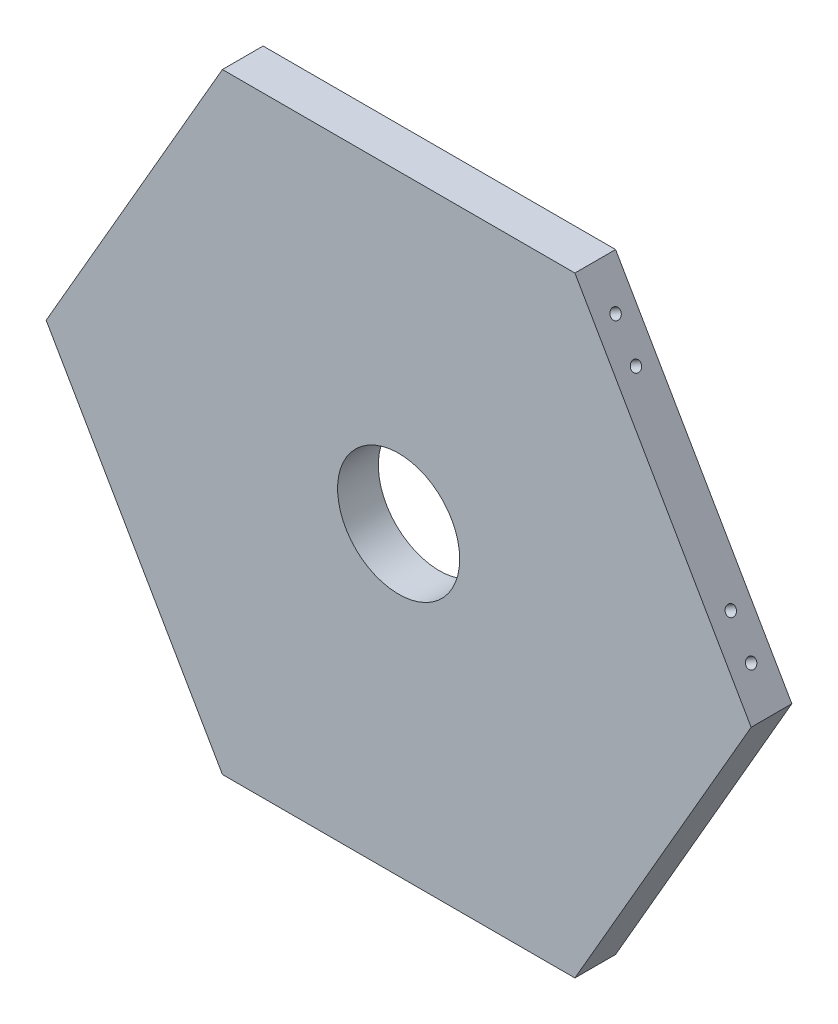
from build123d import *

# Parameters (mm, degrees)
BOSS_EXTRUDE1_DEPTH = 10
SKETCH2_R           = 1.25
CUT_EXTRUDE1_DEPTH  = 5
CIRPATTERN1_COUNT   = 3
SKETCH3_R           = 15
CUT_EXTRUDE2_DEPTH  = 10


with BuildPart() as part:
    # Sketch1 → Boss-Extrude1 (new body)
    with BuildSketch(Plane.XY):
        Polygon((43.301270189, -75), (86.602540378, 0), (43.301270189, 75), (-43.301270189, 75), (-86.602540378, 0), (-43.301270189, -75), align=None)
    extrude(amount=BOSS_EXTRUDE1_DEPTH)

    # Sketch2 → Cut-Extrude1 (cut)
    with BuildSketch(Plane.XZ.offset(75)):
        with Locations((-33.301270189, 5)):
            Circle(SKETCH2_R)
        with Locations((-23.301270189, 5)):
            Circle(SKETCH2_R)
        with Locations(Location((33.301270189, 5, 0), (0, 0, 180))):
            Circle(SKETCH2_R)
        with Locations(Location((23.301270189, 5, 0), (0, 0, 180))):
            Circle(SKETCH2_R)
    cut_extrude1 = extrude(amount=-CUT_EXTRUDE1_DEPTH, mode=Mode.SUBTRACT)

    # CirPattern1: Cut-Extrude1 ×3 about axis
    cirpattern1_axis = Axis((0, 0, 0), (0, 0, 1))
    for i in range(1, CIRPATTERN1_COUNT):
        add(cut_extrude1.rotate(cirpattern1_axis, i * 360 / CIRPATTERN1_COUNT), mode=Mode.SUBTRACT)

    # Sketch3 → Cut-Extrude2 (cut)
    with BuildSketch(Plane.XY.offset(10)):
        Circle(SKETCH3_R)
    extrude(amount=-CUT_EXTRUDE2_DEPTH, mode=Mode.SUBTRACT)


solid = part.part
